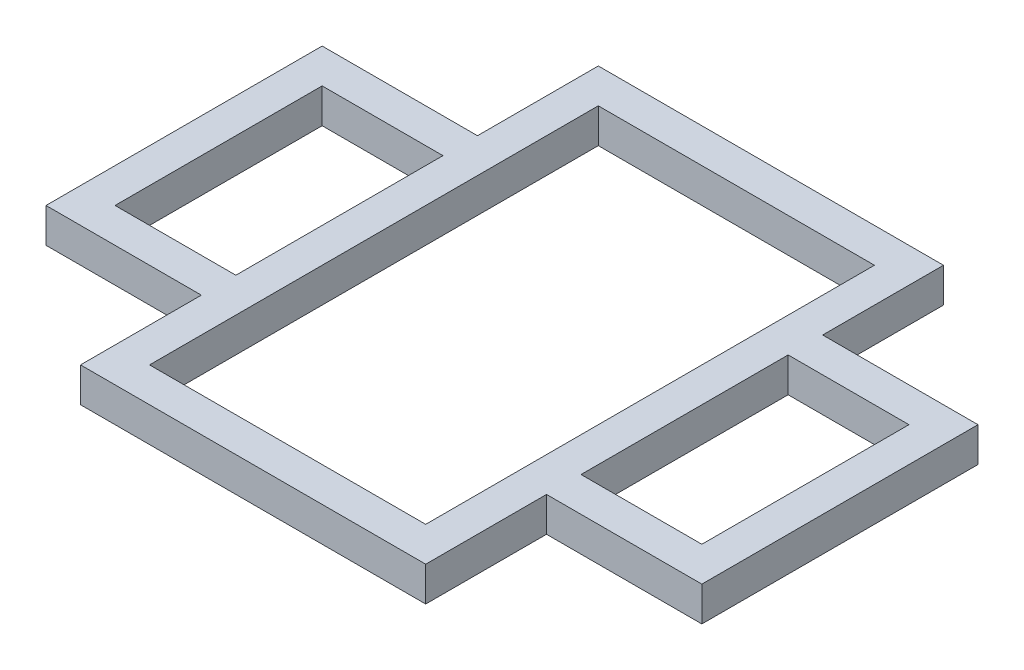
from build123d import *

# Parameters (mm, degrees)
SKETCH4_W           = 70
SKETCH4_H           = 120
BOSS_EXTRUDE2_DEPTH = 20


with BuildPart() as part:
    # Sketch4 → Boss-Extrude2 (new body)
    with BuildSketch(Plane(origin=(0, 0, 0), x_dir=(1, 0, 0), z_dir=(0, 1, 0))):
        Polygon((-100, 150), (100, 150), (100, 80), (190, 80), (190, -80), (100, -80), (100, -150), (-100, -150), (-100, -80), (-190, -80), (-190, 80), (-100, 80), align=None)
        with Locations((135, 0)):
            Rectangle(SKETCH4_W, SKETCH4_H, mode=Mode.SUBTRACT)
        Polygon((-80, 130), (-10, 130), (10, 130), (80, 130), (80, 60), (80, 40), (80, -40), (80, -60), (80, -130), (10, -130), (-10, -130), (-80, -130), (-80, -60), (-80, -40), (-80, 40), (-80, 60), align=None, mode=Mode.SUBTRACT)
        with Locations((-135, 0)):
            Rectangle(SKETCH4_W, SKETCH4_H, mode=Mode.SUBTRACT)
    extrude(amount=BOSS_EXTRUDE2_DEPTH)


solid = part.part
